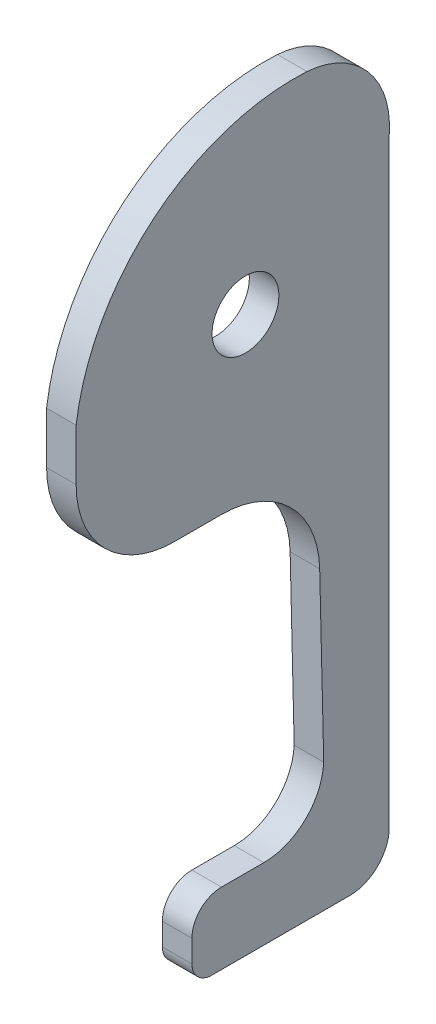
from build123d import *

# Parameters (mm, degrees)
BOSS_EXTRUDE1_DEPTH = 15
SCALE1_SCALE        = 0.147347741
CUT_EXTRUDE1_REACH  = 182.668
SKETCH4_R           = 2.5


with BuildPart() as part:
    # Sketch3 → Boss-Extrude1 (new body)
    with BuildSketch(Plane(origin=(0, 0, 0), x_dir=(0, 0, -1), z_dir=(1, 0, 0))):
        with BuildLine():
            Line((0, -60), (0, -86.184781703))
            ThreePointArc((0, -86.184781703), (14.644660941, -121.540120762), (50, -136.184781703))
            Line((50, -136.184781703), (73.642909299, -136.184781703))
            ThreePointArc((73.642909299, -136.184781703), (108.573727492, -150.409958986), (123.628662427, -184.991264087))
            Line((123.628662427, -184.991264087), (125.683202704, -271.037537481))
            ThreePointArc((125.683202704, -271.037537481), (116.280768167, -291.592024429), (95.295179386, -299.98831959))
            Line((95.295179386, -299.98831959), (73.775693132, -299.98831959))
            ThreePointArc((73.775693132, -299.98831959), (63.169091414, -304.381717872), (58.775693132, -314.98831959))
            Line((58.775693132, -314.98831959), (58.775693132, -326.270417599))
            ThreePointArc((58.775693132, -326.270417599), (61.70462532, -333.341485411), (68.775693132, -336.270417599))
            Line((68.775693132, -336.270417599), (117.262564818, -336.270417599))
            Line((117.262564818, -336.270417599), (138.939006392, -336.270417599))
            ThreePointArc((138.939006392, -336.270417599), (153.081142016, -330.412553223), (158.939006392, -316.270417599))
            Line((158.939006392, -316.270417599), (158.939006392, -146.184781703))
            Line((158.939006392, -146.184781703), (158.939006392, -50))
            Line((158.939006392, -50), (158.939006392, -11.480346054))
            ThreePointArc((158.939006392, -11.480346054), (148.053108697, 21.328755123), (117.156078712, 36.830801017))
            ThreePointArc((117.156078712, 36.830801017), (39.60735059, 11.368133348), (0, -60))
        make_face()
    extrude(amount=BOSS_EXTRUDE1_DEPTH)


with BuildPart() as part_1:
    # Scale1: scaled about (7.5, -112.632543916, -97.960281801)
    add(part.part.scale(SCALE1_SCALE).moved(Location((6.394891943, -96.036393007, -83.52605557))))

    # Sketch4 → Cut-Extrude1 (cut, up to next)
    with BuildSketch(Plane(origin=(8.605108057, 0, 0), x_dir=(0, 0, -1), z_dir=(1, 0, 0)), mode=Mode.PRIVATE) as cut_extrude1_sk1:
        with Locations((96.192054569, -104.044147658)):
            Circle(SKETCH4_R)
    cut_extrude1_tool1 = extrude(cut_extrude1_sk1.sketch, amount=-CUT_EXTRUDE1_REACH, mode=Mode.PRIVATE) & part_1.part
    add(cut_extrude1_tool1.solids().sort_by_distance((8.605108, -104.044148, -96.192055))[0], mode=Mode.SUBTRACT)


solid = part_1.part
